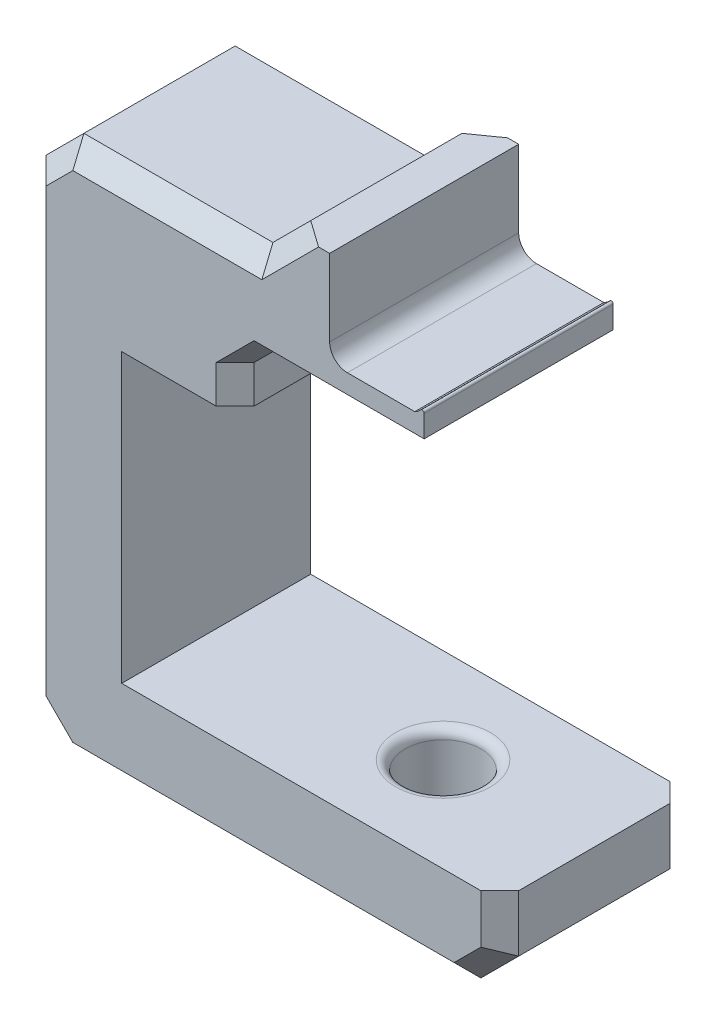
from build123d import *

# Parameters (mm, degrees)
RESSALTO_EXTRUS_O1_DEPTH = 10
ESBO_O3_R                = 2
CORTE_EXTRUS_O1_DEPTH    = 15
CHANFRO1_SIZE            = 1.6
FILETE1_R                = 0.5
FILETE2_R                = 0.94
RESSALTO_EXTRUS_O3_DEPTH = 10
CHANFRO5_SIZE            = 2
CHANFRO4_SIZE            = 1


with BuildPart() as part:
    # Esboço1 → Ressalto-extrusão1 (new body)
    with BuildSketch(Plane.XY):
        with BuildLine():
            Line((11, 14.25), (1, 14.25))
            Line((1, 14.25), (1, 11.25))
            Line((1, 11.25), (-5, 11.25))
            Line((-5, 11.25), (-5, -3.95))
            Line((-5, -3.95), (15, -3.95))
            Line((15, -3.95), (15, -8.95))
            Line((15, -8.95), (-10, -8.95))
            Line((-10, -8.95), (-10, 19.25))
            Line((-10, 19.25), (6, 19.25))
            Line((6, 19.25), (6, 16.25))
            Line((6, 16.25), (10.504380809, 16.25))
            ThreePointArc((10.504380809, 16.25), (10.676386068, 16.357306387), (10.826229508, 16.493861918))
            ThreePointArc((10.826229508, 16.493861918), (10.936214298, 16.519561844), (11, 16.426349589))
            Line((11, 16.426349589), (11, 16.25))
            Line((11, 16.25), (11, 14.25))
        make_face()
    extrude(amount=RESSALTO_EXTRUS_O1_DEPTH)

    # Esboço3 → Corte-extrusão1 (cut)
    with BuildSketch(Plane.XZ.offset(8.95)):
        with Locations(Location((7, 5, 0), (0, 0, 270))):
            Circle(ESBO_O3_R)
    extrude(amount=-CORTE_EXTRUS_O1_DEPTH, mode=Mode.SUBTRACT)

    # Chanfro1
    chanfro1_edges = [part.edges().sort_by_distance(p)[0] for p in [
        (7, -8.95, 7),
    ]]
    chamfer(chanfro1_edges, length=CHANFRO1_SIZE)

    # Filete1
    filete1_edges = [part.edges().sort_by_distance(p)[0] for p in [
        (7, -3.95, 7),
    ]]
    fillet(filete1_edges, radius=FILETE1_R)

    # Filete2
    filete2_edges = [part.edges().sort_by_distance(p)[0] for p in [
        (6, 16.25, 5),
    ]]
    fillet(filete2_edges, radius=FILETE2_R)

    # Esboço5 → Ressalto-extrusão3 (add)
    with BuildSketch(Plane.XY.offset(10)):
        Polygon((6, 19.25), (6, 21.25), (4, 21.25), (2, 19.25), align=None)
    extrude(amount=-RESSALTO_EXTRUS_O3_DEPTH)

    # Chanfro5
    chanfro5_edges = [part.edges().sort_by_distance(p)[0] for p in [
        (15, -8.95, 5),
        (-10, -8.95, 5),
        (-10, 19.25, 5),
    ]]
    chamfer(chanfro5_edges, length=CHANFRO5_SIZE)

    # Chanfro4
    chanfro4_edges = [part.edges().sort_by_distance(p)[0] for p in [
        (6, 14.25, 0),
        (1, 12.75, 0),
        (11, 14.25, 5),
        (1, 14.25, 5),
        (1, 12.75, 10),
        (-3, 19.25, 0),
        (-3, 19.25, 10),
        (3, 20.25, 10),
        (3, 20.25, 0),
        (15, -5.45, 0),
        (15, -5.45, 10),
        (2.5, -8.95, 0),
        (-10, 5.15, 0),
        (-9, 18.25, 0),
        (-9, -7.95, 0),
        (14, -7.95, 0),
        (2.5, -8.95, 10),
        (-10, 5.15, 10),
        (-9, 18.25, 10),
        (-9, -7.95, 10),
        (14, -7.95, 10),
        (6, 14.25, 10),
    ]]
    chamfer(chanfro4_edges, length=CHANFRO4_SIZE)


solid = part.part
